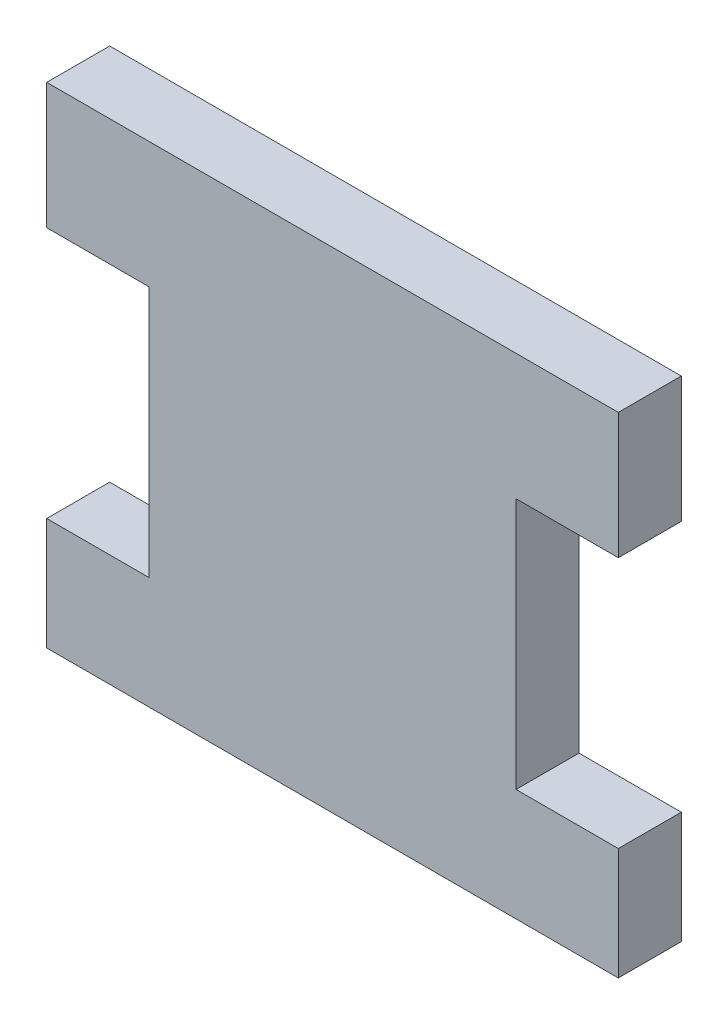
from build123d import *

# Parameters (mm, degrees)
BOSS_EXTRUDE1_DEPTH = 0.25


with BuildPart() as part:
    # Sketch1 → Boss-Extrude1 (new body)
    with BuildSketch(Plane.XY):
        Polygon((1.135, -0.9140625), (-1.135, -0.9140625), (-1.135, -0.46875), (-0.72875, -0.46875), (-0.72875, 0.53125), (-1.135, 0.53125), (-1.135, 1.03125), (1.135, 1.03125), (1.135, 0.53125), (0.72875, 0.53125), (0.72875, -0.46875), (1.135, -0.46875), align=None)
    extrude(amount=BOSS_EXTRUDE1_DEPTH)


solid = part.part
